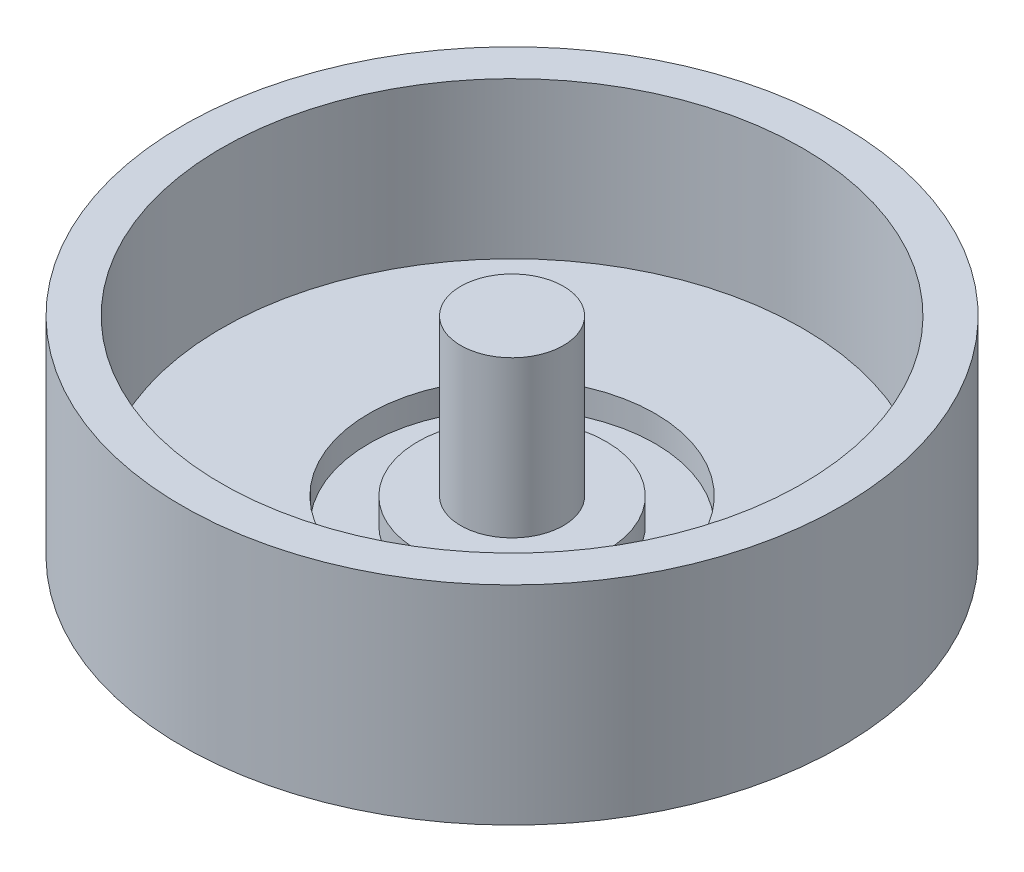
from build123d import *


with BuildPart() as part:
    # Sketch1 → Revolve1 (revolve)
    with BuildSketch(Plane(origin=(0, 0, 0), x_dir=(0, 0, -1), z_dir=(1, 0, 0))):
        Polygon((0, 0), (0, 16), (3.95, 16), (3.95, 4), (7.25, 4), (7.25, 2), (11, 2), (11, 4), (22.35, 4), (22.35, 16), (25.35, 16), (25.35, 0), align=None)
    revolve(axis=Axis((0, 0, 0), (0, 1, 0)))


solid = part.part
